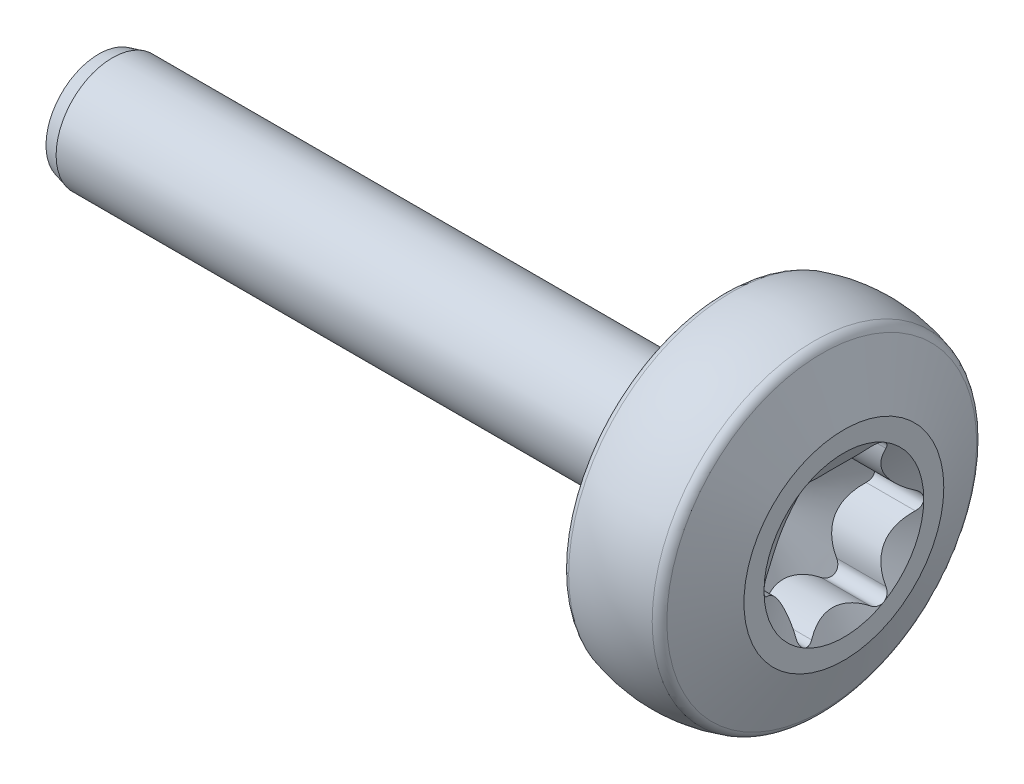
from build123d import *

# Parameters (mm, degrees)
BOSS_EXTRUDE1_REACH = 17.92
SKETCH3_R           = 2.0335875
FILLET1_R           = 0.24638
CHAMFER1_SIZE       = 0.280736842
CHAMFER1_SIZE2      = 0.07522321


with BuildPart() as part:
    # Sketch2 → Revolve1 (revolve)
    with BuildSketch(Plane.XY):
        with BuildLine():
            Line((-7.5819, 0), (7.5819, 0))
            Line((7.5819, 0), (7.5819, 2.0335875))
            Line((7.5819, 2.0335875), (7.08914, 3.25755))
            ThreePointArc((7.08914, 3.25755), (6.10362, 3.429), (5.1181, 3.25755))
            Line((5.1181, 3.25755), (5.1181, 1.927169298))
            ThreePointArc((5.1181, 1.927169298), (5.106940768, 1.90022853), (5.08, 1.889069298))
            ThreePointArc((5.08, 1.889069298), (5.053059232, 1.877910067), (5.0419, 1.850969298))
            Line((5.0419, 1.850969298), (5.0419, 1.147678947))
            Line((5.0419, 1.147678947), (-7.5819, 1.147678947))
            Line((-7.5819, 1.147678947), (-7.5819, 0))
        make_face()
    revolve(axis=Axis((-7.5819, 0, 0), (-1, 0, 0)))

    # Sketch12 → Cut-Revolve3 (revolve, cut)
    with BuildSketch(Plane.XY):
        Polygon((7.5819, 1.6256), (6.58098125, 1.6256), (5.642440652, 0), (7.5819, 0), align=None)
    revolve(axis=Axis((-7.5819, 0, 0), (1, 0, 0)), mode=Mode.SUBTRACT)

    # Boss-Extrude1: up to this cone (the profile starts inside it)
    boss_extrude1_end = Plane(origin=(7.5819, 0, 0), z_dir=(1, 0, 0)).offset(-1.939458348) * Cone(1.732e-06, 41.081996047, 23.718700477, align=(Align.CENTER, Align.CENTER, Align.MIN), mode=Mode.PRIVATE)
    # Sketch3 → Boss-Extrude1 (add, up to the surface)
    with BuildSketch(Plane(origin=(7.5819, 0, 0), x_dir=(0, 0, -1), z_dir=(1, 0, 0)), mode=Mode.PRIVATE) as boss_extrude1_sk1:
        Circle(SKETCH3_R)
        with BuildLine():
            ThreePointArc((1.51222877, -0.182266377), (1.594944844, -0.107324354), (1.6256, 0))
            ThreePointArc((1.6256, 0), (1.594944844, 0.107324354), (1.51222877, 0.182266377))
            ThreePointArc((1.51222877, 0.182266377), (1.055858172, 0.6096), (0.913961698, 1.218495343))
            ThreePointArc((0.913961698, 1.218495343), (0.890418039, 1.327600575), (0.8128, 1.407810896))
            ThreePointArc((0.8128, 1.407810896), (0.704526805, 1.434924929), (0.598267073, 1.40076172))
            ThreePointArc((0.598267073, 1.40076172), (0, 1.2192), (-0.598267073, 1.40076172))
            ThreePointArc((-0.598267073, 1.40076172), (-0.704526805, 1.434924929), (-0.8128, 1.407810896))
            ThreePointArc((-0.8128, 1.407810896), (-0.890418039, 1.327600575), (-0.913961698, 1.218495343))
            ThreePointArc((-0.913961698, 1.218495343), (-1.055858172, 0.6096), (-1.51222877, 0.182266377))
            ThreePointArc((-1.51222877, 0.182266377), (-1.594944844, 0.107324354), (-1.6256, 0))
            ThreePointArc((-1.6256, 0), (-1.594944844, -0.107324354), (-1.51222877, -0.182266377))
            ThreePointArc((-1.51222877, -0.182266377), (-1.055858172, -0.6096), (-0.913961698, -1.218495343))
            ThreePointArc((-0.913961698, -1.218495343), (-0.890418039, -1.327600575), (-0.8128, -1.407810896))
            ThreePointArc((-0.8128, -1.407810896), (-0.704526805, -1.434924929), (-0.598267073, -1.40076172))
            ThreePointArc((-0.598267073, -1.40076172), (0, -1.2192), (0.598267073, -1.40076172))
            ThreePointArc((0.598267073, -1.40076172), (0.704526805, -1.434924929), (0.8128, -1.407810896))
            ThreePointArc((0.8128, -1.407810896), (0.890418039, -1.327600575), (0.913961698, -1.218495343))
            ThreePointArc((0.913961698, -1.218495343), (1.055858172, -0.6096), (1.51222877, -0.182266377))
        make_face(mode=Mode.SUBTRACT)
    boss_extrude1_tool1 = extrude(boss_extrude1_sk1.sketch, amount=-BOSS_EXTRUDE1_REACH, mode=Mode.PRIVATE) & boss_extrude1_end
    add(boss_extrude1_tool1.solids().sort_by_distance((7.5819, 0, 1.976069))[0])

    # Cut-Extrude2 cone 1 section (through the dimple's axis) → Cut-Extrude2 (revolve, cut)
    with BuildSketch(Plane(origin=(7.5819, 0, 0), x_dir=(0, 0, -1), z_dir=(0, 1, 0))):
        Polygon((0, 0), (1.6256, 0), (0, 0.938540598), align=None)
    revolve(axis=Axis((7.5819, 0, 0), (-1, 0, 0)), mode=Mode.SUBTRACT)

    # Fillet1
    fillet1_edges = [part.edges().sort_by_distance(p)[0] for p in [
        (5.1181, -3.25755, 0),
        (7.08914, -3.25755, 0),
    ]]
    fillet(fillet1_edges, radius=FILLET1_R)

    # Chamfer1
    chamfer1_edges = [part.edges().sort_by_distance(p)[0] for p in [
        (-7.5819, -1.147678947, 0),
    ]]
    chamfer1_side = [part.faces().sort_by_distance(p)[0] for p in [
        (-1.27, -1.147678947, 0),
    ]]
    chamfer(chamfer1_edges, length=CHAMFER1_SIZE, length2=CHAMFER1_SIZE2, reference=chamfer1_side[0])


solid = part.part
